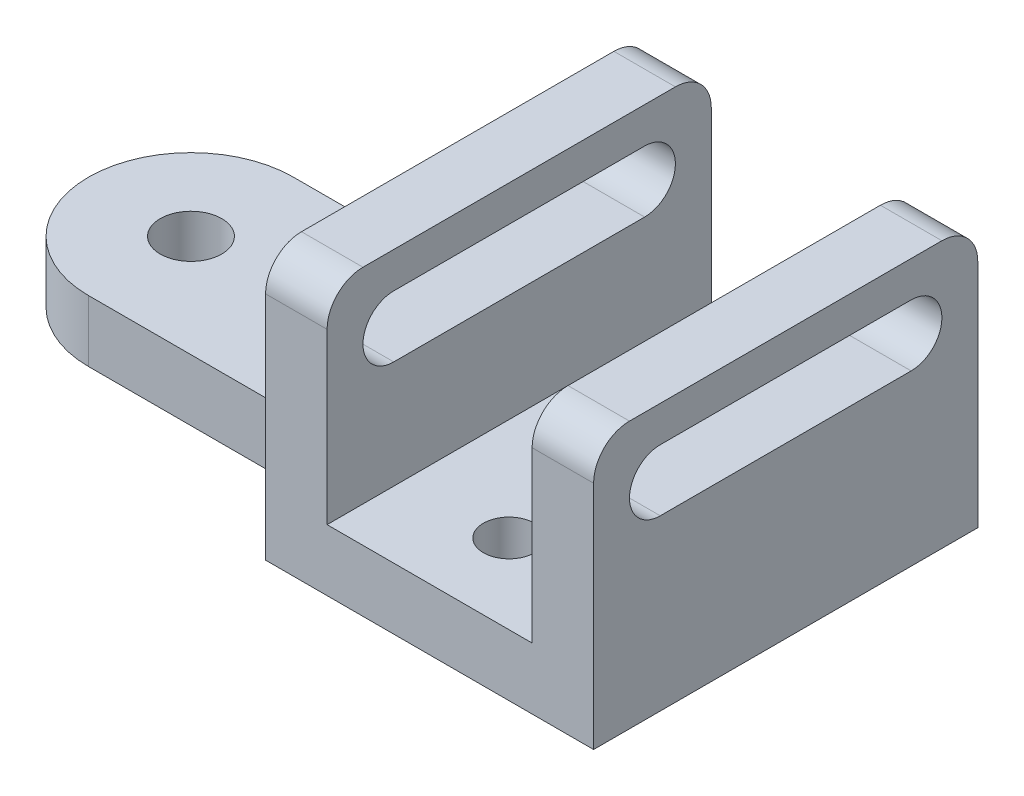
from build123d import *

# Parameters (mm, degrees)
SKETCH1_R           = 6
SKETCH1_R_2         = 5
BOSS_EXTRUDE1_DEPTH = 12
BOSS_EXTRUDE2_DEPTH = 12
CUT_EXTRUDE1_DEPTH  = 150.263087319


with BuildPart() as part:
    # Sketch1 → Boss-Extrude1 (new body)
    with BuildSketch(Plane(origin=(0, 0, 0), x_dir=(1, 0, 0), z_dir=(0, 1, 0))):
        with BuildLine():
            Line((-49.533874762, 40.242629587), (-113.533874762, 40.242629587))
            Line((-113.533874762, 40.242629587), (-113.533874762, 30.681729378))
            ThreePointArc((-113.533874762, 30.681729378), (-116.46280695, 23.610661566), (-123.533874762, 20.681729378))
            Line((-123.533874762, 20.681729378), (-163.533874762, 20.681729378))
            ThreePointArc((-163.533874762, 20.681729378), (-183.533874762, 0.681729378), (-163.533874762, -19.318270622))
            Line((-163.533874762, -19.318270622), (-123.533874762, -19.318270622))
            ThreePointArc((-123.533874762, -19.318270622), (-116.46280695, -22.24720281), (-113.533874762, -29.318270622))
            Line((-113.533874762, -29.318270622), (-113.533874762, -34.757370413))
            Line((-113.533874762, -34.757370413), (-49.533874762, -34.757370413))
            Line((-49.533874762, -34.757370413), (-49.533874762, 40.242629587))
        make_face()
        with Locations((-163.533874762, 0.681729378)):
            Circle(SKETCH1_R, mode=Mode.SUBTRACT)
        with Locations((-81.533874762, -19.257370413)):
            Circle(SKETCH1_R_2, mode=Mode.SUBTRACT)
        with Locations((-81.533874762, 24.742629587)):
            Circle(SKETCH1_R_2, mode=Mode.SUBTRACT)
    extrude(amount=BOSS_EXTRUDE1_DEPTH)

    # Sketch3 → Boss-Extrude2 (add)
    with BuildSketch(Plane(origin=(-49.533874762, 0, 0), x_dir=(0, 0, -1), z_dir=(1, 0, 0))):
        with BuildLine():
            Line((-34.757370413, 12), (40.199591679, 12))
            Line((40.199591679, 12), (40.199591679, 45))
            ThreePointArc((40.199591679, 45), (38.149339148, 49.949747468), (33.199591679, 52))
            Line((33.199591679, 52), (-27.757370413, 52))
            ThreePointArc((-27.757370413, 52), (-32.707117881, 49.949747468), (-34.757370413, 45))
            Line((-34.757370413, 45), (-34.757370413, 12))
        make_face()
    boss_extrude2 = extrude(amount=-BOSS_EXTRUDE2_DEPTH)

    # Sketch5 → Cut-Extrude1 (cut, through all)
    with BuildSketch(Plane(origin=(-49.533874762, 0, 0), x_dir=(0, 0, -1), z_dir=(1, 0, 0))):
        with BuildLine():
            Line((-21.757370413, 45), (27.199591679, 45))
            ThreePointArc((27.199591679, 45), (33.199591679, 39), (27.199591679, 33))
            Line((27.199591679, 33), (-21.757370413, 33))
            ThreePointArc((-21.757370413, 33), (-27.757370413, 39), (-21.757370413, 45))
        make_face()
    cut_extrude1 = extrude(amount=-CUT_EXTRUDE1_DEPTH, mode=Mode.SUBTRACT)

    # Mirror1: Boss-Extrude2, Cut-Extrude1 across plane
    add(boss_extrude2.mirror(Plane(origin=(-81.533874762, 0, 0), x_dir=(0, 0, 1), z_dir=(1, 0, 0))))
    add(cut_extrude1.mirror(Plane(origin=(-81.533874762, 0, 0), x_dir=(0, 0, 1), z_dir=(1, 0, 0))), mode=Mode.SUBTRACT)


solid = part.part
